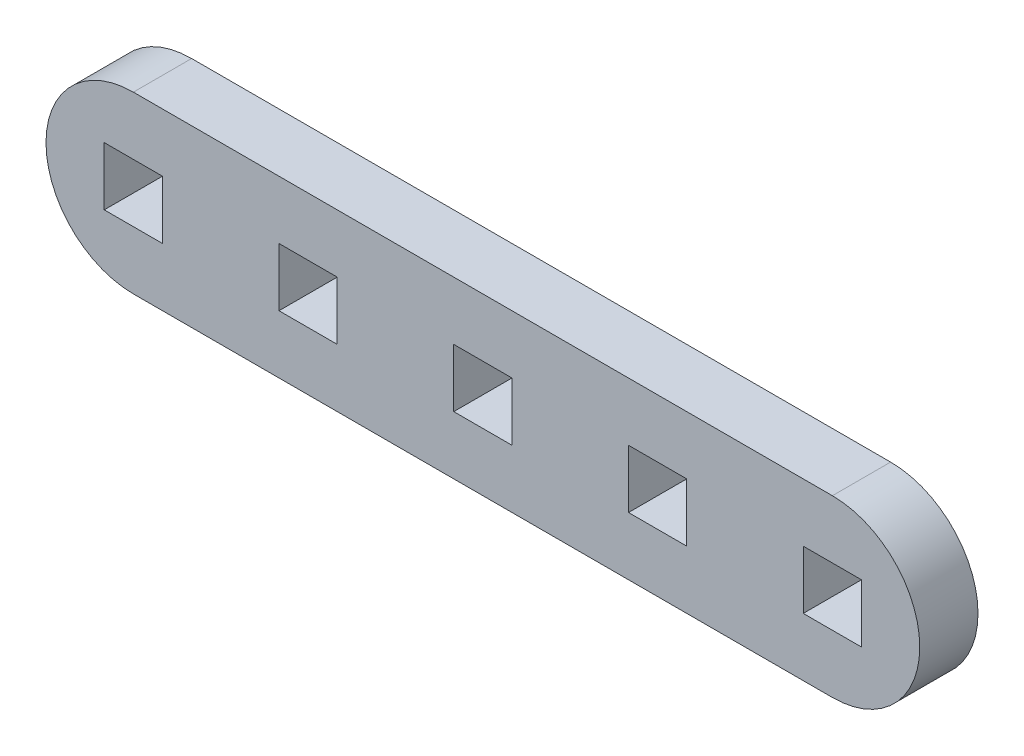
from build123d import *

# Parameters (mm, degrees)
MODEL_W                 = 3
MODEL_H                 = 3
SALIENTE_EXTRUIR1_DEPTH = 3


with BuildPart() as part:
    # Model → Saliente-Extruir1 (new body)
    with BuildSketch(Plane.XY):
        with BuildLine():
            Line((11.412749203, 297.239922936), (47.412749203, 297.239922936))
            ThreePointArc((47.412749203, 297.239922936), (51.912749203, 292.739922936), (47.412749203, 288.239922936))
            Line((47.412749203, 288.239922936), (11.412749203, 288.239922936))
            ThreePointArc((11.412749203, 288.239922936), (6.912749203, 292.739922936), (11.412749203, 297.239922936))
        make_face()
        with Locations((11.412749203, 292.739922936)):
            Rectangle(MODEL_W, MODEL_H, mode=Mode.SUBTRACT)
        with Locations((20.412749203, 292.739922936)):
            Rectangle(MODEL_W, MODEL_H, mode=Mode.SUBTRACT)
        with Locations((29.412749203, 292.739922936)):
            Rectangle(MODEL_W, MODEL_H, mode=Mode.SUBTRACT)
        with Locations((38.412749203, 292.739922936)):
            Rectangle(MODEL_W, MODEL_H, mode=Mode.SUBTRACT)
        with Locations((47.412749203, 292.739922936)):
            Rectangle(MODEL_W, MODEL_H, mode=Mode.SUBTRACT)
    extrude(amount=SALIENTE_EXTRUIR1_DEPTH)


solid = part.part
